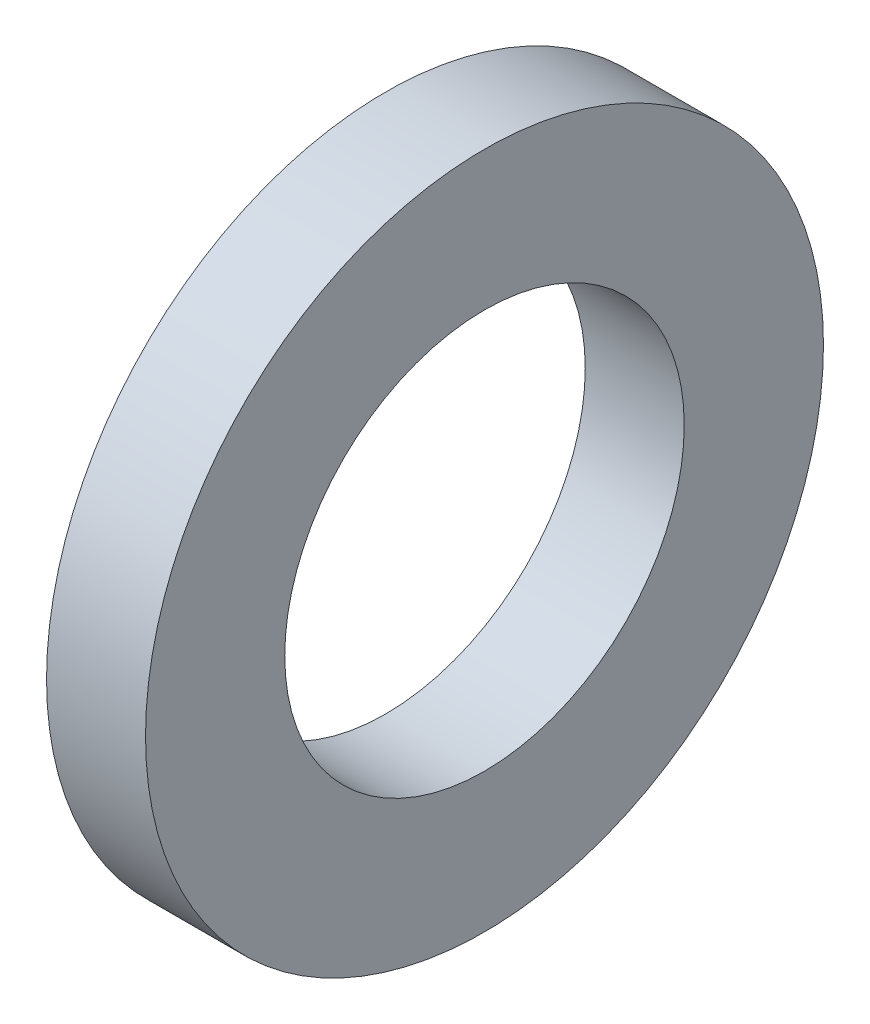
from build123d import *

# Parameters (mm, degrees)
SKETCH1_R           = 8.89
SKETCH1_R_2         = 5.23875
BOSS_EXTRUDE1_DEPTH = 1.29794


with BuildPart() as part:
    # Sketch1 → Boss-Extrude1 (new, symmetric)
    with BuildSketch(Plane(origin=(0, 0, 0), x_dir=(0, 0, -1), z_dir=(1, 0, 0))):
        Circle(SKETCH1_R)
        Circle(SKETCH1_R_2, mode=Mode.SUBTRACT)
    extrude(amount=BOSS_EXTRUDE1_DEPTH, both=True)


solid = part.part
